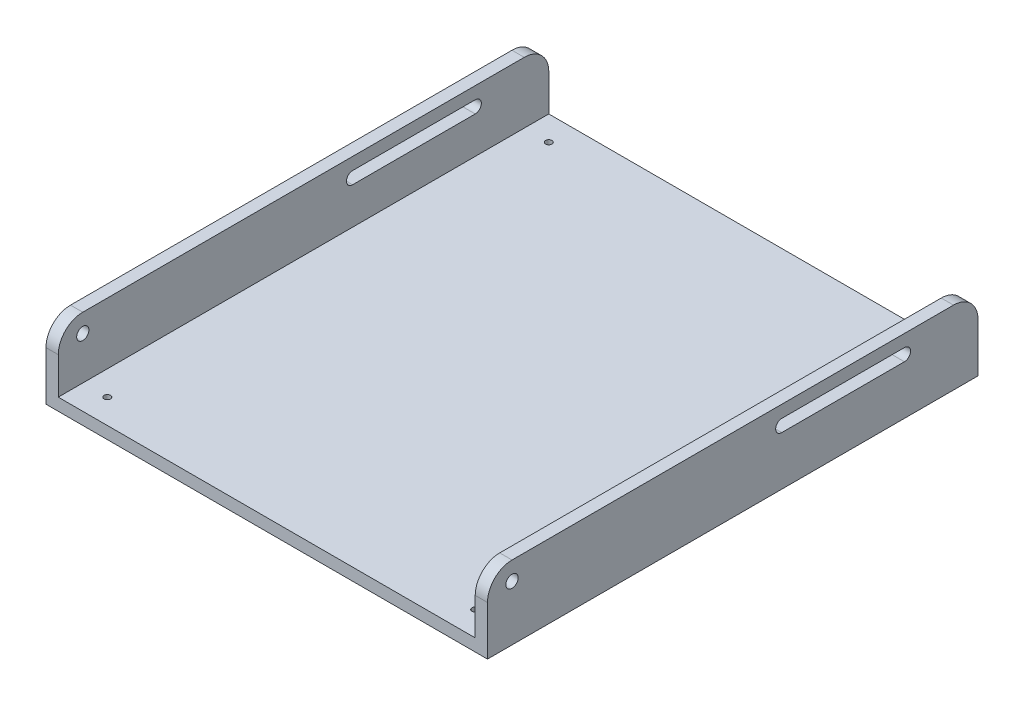
from build123d import *

# Parameters (mm, degrees)
EXTRUDE_THIN1_DEPTH                      = 200
CUT_EXTRUDE1_DEPTH                       = 364
SKETCH3_R                                = 5
CUT_EXTRUDE2_DEPTH                       = 417.173040934
RADYUS1_R                                = 20
M5_HELISARMAL_I_IN_Z_VANA_MATKAB_1_D     = 5.2
M5_HELISARMAL_I_IN_Z_VANA_MATKAB_1_DEPTH = 12
M5_HELISARMAL_I_IN_Z_VANA_MATKAB_1_TIP   = 1.562237609


with BuildPart() as part:
    # Sketch1 → Extrude-Thin1 (new, symmetric)
    with BuildSketch(Plane.XY):
        Polygon((-150, 60), (-150, 0), (210, 0), (210, 60), (200, 60), (200, 10), (-140, 10), (-140, 60), align=None)
    extrude(amount=EXTRUDE_THIN1_DEPTH, both=True)

    # Sketch2 → Cut-Extrude1 (cut)
    with BuildSketch(Plane(origin=(210, 0, 0), x_dir=(0, 0, -1), z_dir=(1, 0, 0))):
        with BuildLine():
            Line((40, 50), (140, 50))
            ThreePointArc((140, 50), (145, 45), (140, 40))
            Line((140, 40), (40, 40))
            ThreePointArc((40, 40), (35, 45), (40, 50))
        make_face()
    extrude(amount=-CUT_EXTRUDE1_DEPTH, mode=Mode.SUBTRACT)

    # Sketch3 → Cut-Extrude2 (cut, through all)
    with BuildSketch(Plane.ZY.offset(150)):
        with Locations((180, 45)):
            Circle(SKETCH3_R)
    extrude(amount=-CUT_EXTRUDE2_DEPTH, mode=Mode.SUBTRACT)

    # Radyus1
    radyus1_edges = [part.edges().sort_by_distance(p)[0] for p in [
        (205, 60, 200),
        (-145, 60, 200),
        (205, 60, -200),
        (-145, 60, -200),
    ]]
    fillet(radyus1_edges, radius=RADYUS1_R)

    # M5 Helisarmal için Zıvana matkabı1
    with Locations(Plane(origin=(-120, 10, 180), x_dir=(0, 0, 1), z_dir=(0, 1, 0))):
        with Locations((0, 0), (0, 300), (-360, 300), (-360, 0)):
            Hole(M5_HELISARMAL_I_IN_Z_VANA_MATKAB_1_D / 2, depth=M5_HELISARMAL_I_IN_Z_VANA_MATKAB_1_DEPTH)
            with Locations((0, 0, -(M5_HELISARMAL_I_IN_Z_VANA_MATKAB_1_DEPTH + M5_HELISARMAL_I_IN_Z_VANA_MATKAB_1_TIP / 2))):  # 118° drill point
                Cone(0, M5_HELISARMAL_I_IN_Z_VANA_MATKAB_1_D / 2, M5_HELISARMAL_I_IN_Z_VANA_MATKAB_1_TIP, mode=Mode.SUBTRACT)


solid = part.part
